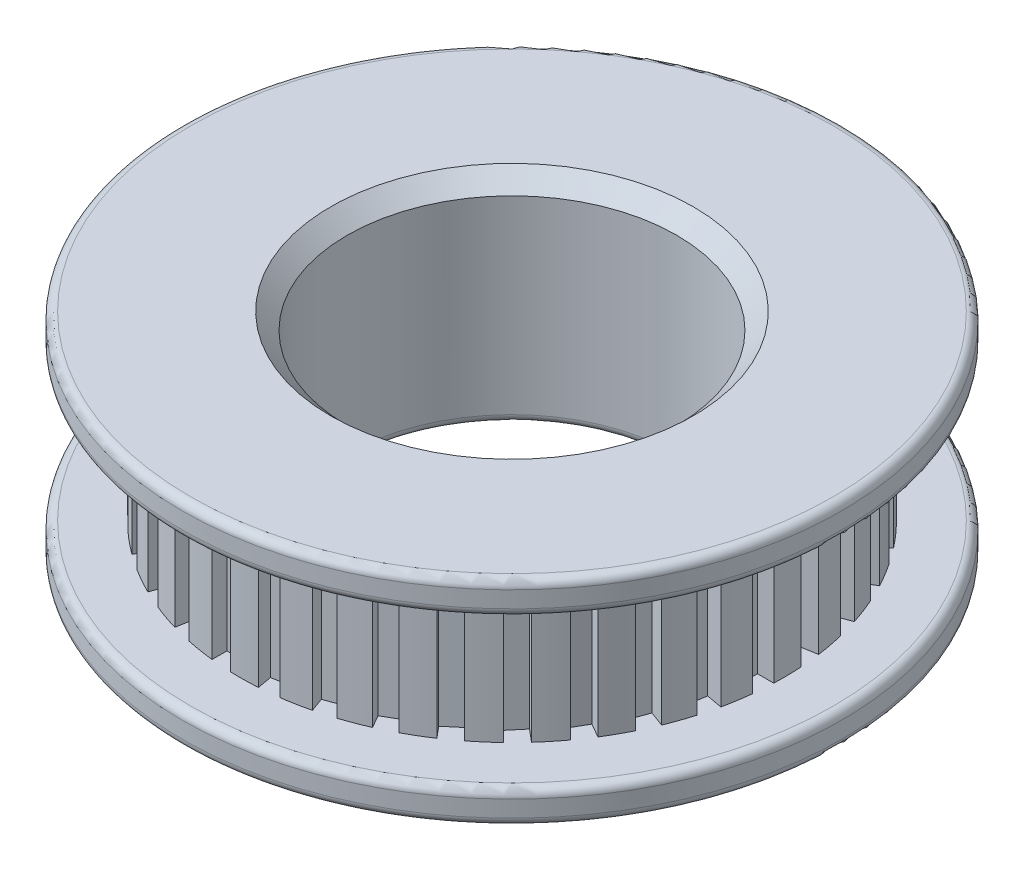
from build123d import *

# Parameters (mm, degrees)
CHAMFER1_SIZE      = 25.4
FILLET1_R          = 12.7
SKETCH3_W          = 30.48
SKETCH3_H          = 30.48
CUT_EXTRUDE1_DEPTH = 228.6
CIRPATTERN1_COUNT  = 36
FILLET2_R          = 12.7


with BuildPart() as part:
    # Sketch1 → Revolve1 (revolve)
    with BuildSketch(Plane.XY, mode=Mode.PRIVATE) as revolve1_sk:
        Polygon((254, 0), (508, 0), (508, 50.8), (419.1, 50.8), (419.1, 279.4), (508, 279.4), (508, 330.2), (254, 330.2), align=None)
    revolve(revolve1_sk.sketch.rotate(Axis((0, 0, 0), (0, 1, 0)), 90), axis=Axis((0, 0, 0), (0, 1, 0)))

    # Chamfer1
    chamfer1_edges = [part.edges().sort_by_distance(p)[0] for p in [
        (0, 330.2, 254),
    ]]
    chamfer(chamfer1_edges, length=CHAMFER1_SIZE)

    # Fillet1
    fillet1_edges = [part.edges().sort_by_distance(p)[0] for p in [
        (0, 330.2, 508),
        (0, 279.4, 508),
        (0, 50.8, 508),
        (0, 0, 508),
    ]]
    fillet(fillet1_edges, radius=FILLET1_R)

    # Sketch3 → Cut-Extrude1 (cut)
    with BuildSketch(Plane(origin=(0, 50.8, 0), x_dir=(1, 0, 0), z_dir=(0, 1, 0))):
        with Locations((30.48, 408.94)):
            Rectangle(SKETCH3_W, SKETCH3_H)
    cut_extrude1 = extrude(amount=CUT_EXTRUDE1_DEPTH, mode=Mode.SUBTRACT)

    # CirPattern1: Cut-Extrude1 ×36 about axis
    cirpattern1_axis = Axis((0, 0, 0), (0, 1, 0))
    for i in range(1, CIRPATTERN1_COUNT):
        add(cut_extrude1.rotate(cirpattern1_axis, i * 360 / CIRPATTERN1_COUNT), mode=Mode.SUBTRACT)

    # Fillet2
    fillet2_edges = [part.edges().sort_by_distance(p)[0] for p in [
        (0, 0, 254),
    ]]
    fillet(fillet2_edges, radius=FILLET2_R)


solid = part.part
